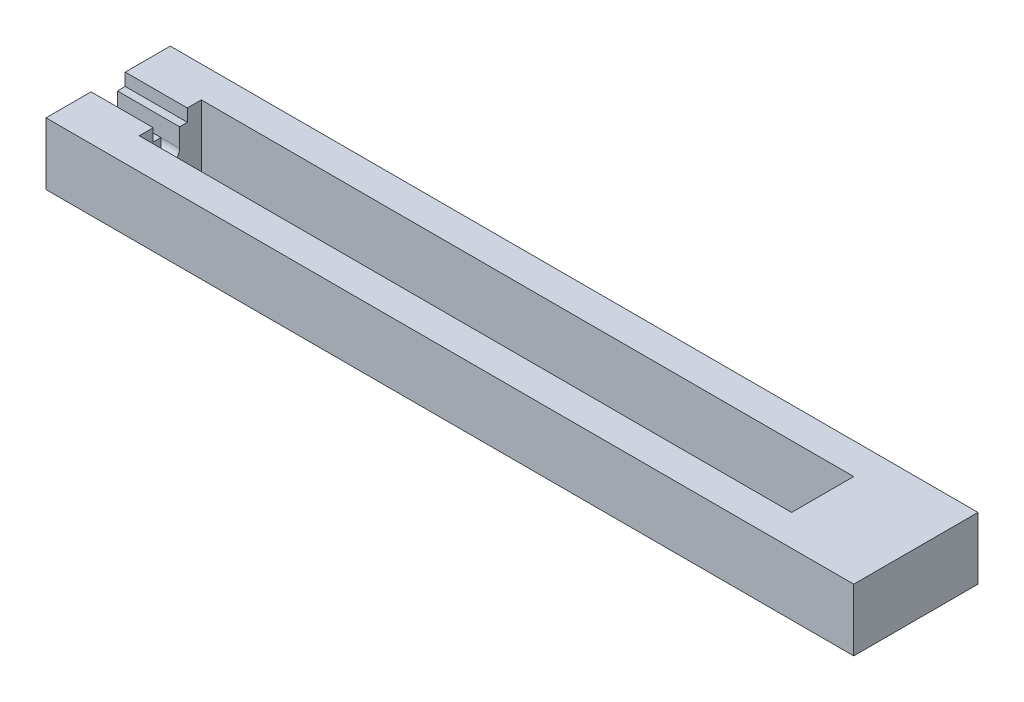
from build123d import *

# Parameters (mm, degrees)
SKETCH1_W           = 13
SKETCH1_H           = 2
SKETCH1_W_2         = 10.5
SKETCH1_H_2         = 1
BOSS_EXTRUDE1_DEPTH = 1
CUT_EXTRUDE2_DEPTH  = 1


with BuildPart() as part:
    # Sketch1 → Boss-Extrude1 (new body)
    with BuildSketch(Plane(origin=(0, 0, 0), x_dir=(1, 0, 0), z_dir=(0, 1, 0))):
        Rectangle(SKETCH1_W, SKETCH1_H)
        with Locations((-0.25, 0)):
            Rectangle(SKETCH1_W_2, SKETCH1_H_2, mode=Mode.SUBTRACT)
    extrude(amount=BOSS_EXTRUDE1_DEPTH)

    # Sketch2 → Cut-Extrude2 (cut)
    with BuildSketch(Plane.ZY.offset(6.5)):
        with BuildLine():
            Line((0.15, 0.5), (0.15, 0.8))
            Line((0.15, 0.8), (0.275, 0.8))
            Line((0.275, 0.8), (0.275, 1))
            Line((0.275, 1), (0.15, 1))
            Line((0.15, 1), (-0.15, 1))
            Line((-0.15, 1), (-0.275, 1))
            Line((-0.275, 1), (-0.275, 0.8))
            Line((-0.275, 0.8), (-0.15, 0.8))
            Line((-0.15, 0.8), (-0.15, 0.5))
            ThreePointArc((-0.15, 0.5), (0, 0.35), (0.15, 0.5))
        make_face()
    extrude(amount=-CUT_EXTRUDE2_DEPTH, mode=Mode.SUBTRACT)


solid = part.part
